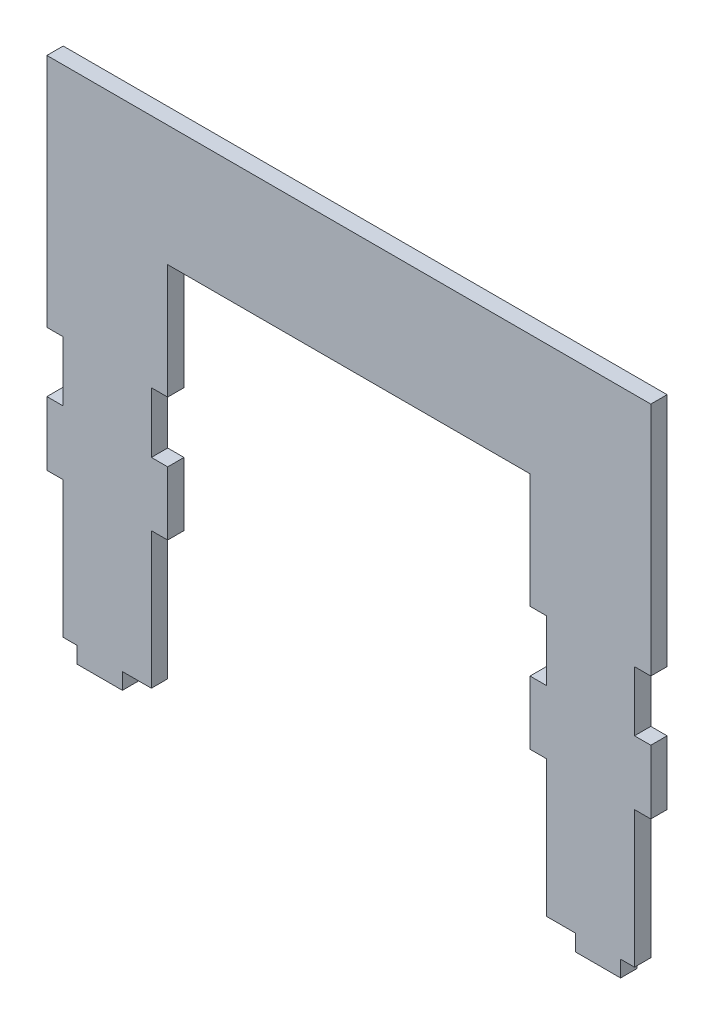
from build123d import *

# Parameters (mm, degrees)
BASE_DEPTH = 2.7


with BuildPart() as part:
    # Sketch1 → Base (new body)
    with BuildSketch(Plane.XY):
        Polygon((-32.7, -12.602642531), (-32.7, 10), (-30, 10), (-30, 20.5), (-32.7, 20.5), (-32.7, 30.5), (-30, 30.5), (-30, 49.5), (30, 49.5), (30, 30.5), (32.7, 30.5), (32.7, 20.5), (30, 20.5), (30, 10), (32.7, 10), (32.7, -12.602642531), (37.5, -12.602642531), (37.5, -15.302642531), (45, -15.302642531), (45, -12.602642531), (47.3, -12.602642531), (47.3, 10), (50, 10), (50, 20.579195959), (47.3, 20.579195959), (47.3, 30.5), (50, 30.5), (50, 69.5), (-50, 69.5), (-50, 30.5), (-47.3, 30.5), (-47.3, 20.579195959), (-50, 20.579195959), (-50, 10), (-47.3, 10), (-47.3, -12.602642531), (-45, -12.602642531), (-45, -15.302642531), (-37.5, -15.302642531), (-37.5, -12.602642531), align=None)
    extrude(amount=BASE_DEPTH)


solid = part.part
